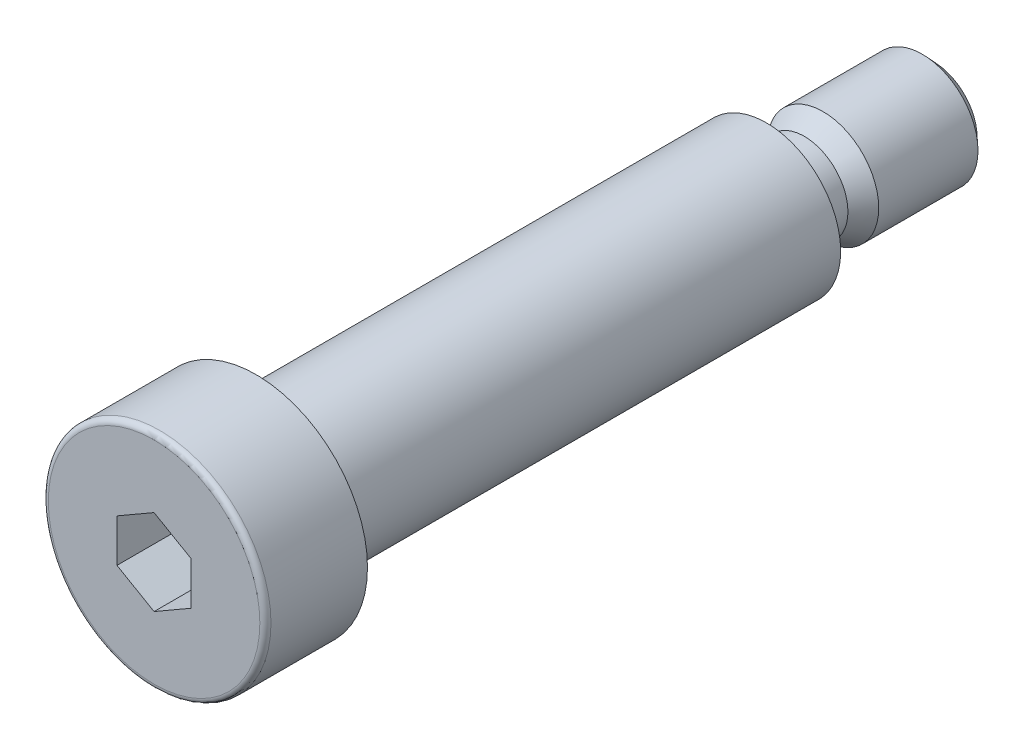
from build123d import *

# Parameters (mm, degrees)
SZKIC1_W                   = 4.7
SZKIC1_H                   = 4.08
WYTNIJ_WYCI_GNI_CIE1_DEPTH = 6.6
ZAOKR_GLENIE1_R            = 0.6


with BuildPart() as part:
    # Szkic1 → Obrót1 (revolve)
    with BuildSketch(Plane(origin=(0, 0, 0), x_dir=(1, 0, 0), z_dir=(0, 1, 0)), mode=Mode.PRIVATE) as obr_t1_sk:
        Polygon((0, -38.5), (0, -27.5), (-8, -27.5), (-12, -27.5), (-12, -38.5), align=None)
        Polygon((0, -27.5), (0, 27.5), (-4.7, 27.5), (-8, 27.5), (-8, -27.5), align=None)
        with Locations((-2.35, 29.54)):
            Rectangle(SZKIC1_W, SZKIC1_H)
        Polygon((-4.7, 31.58), (0, 31.58), (0, 45.5), (-4.7, 45.5), (-6, 44.3), (-6, 33.6), align=None)
    revolve(obr_t1_sk.sketch.rotate(Axis((0, 0, 38.5), (0, 0, -1)), 180), axis=Axis((0, 0, 38.5), (0, 0, -1)))

    # Szkic2 → Wytnij-wyciągnięcie1 (cut)
    with BuildSketch(Plane.XY.offset(38.5)):
        Polygon((4, 2.309401077), (0, 4.618802154), (-4, 2.309401077), (-4, -2.309401077), (0, -4.618802154), (4, -2.309401077), align=None)
    extrude(amount=-WYTNIJ_WYCI_GNI_CIE1_DEPTH, mode=Mode.SUBTRACT)

    # Zaokrąglenie1
    zaokr_glenie1_edges = [part.edges().sort_by_distance(p)[0] for p in [
        (-12, 0, 38.5),
    ]]
    fillet(zaokr_glenie1_edges, radius=ZAOKR_GLENIE1_R)


solid = part.part
